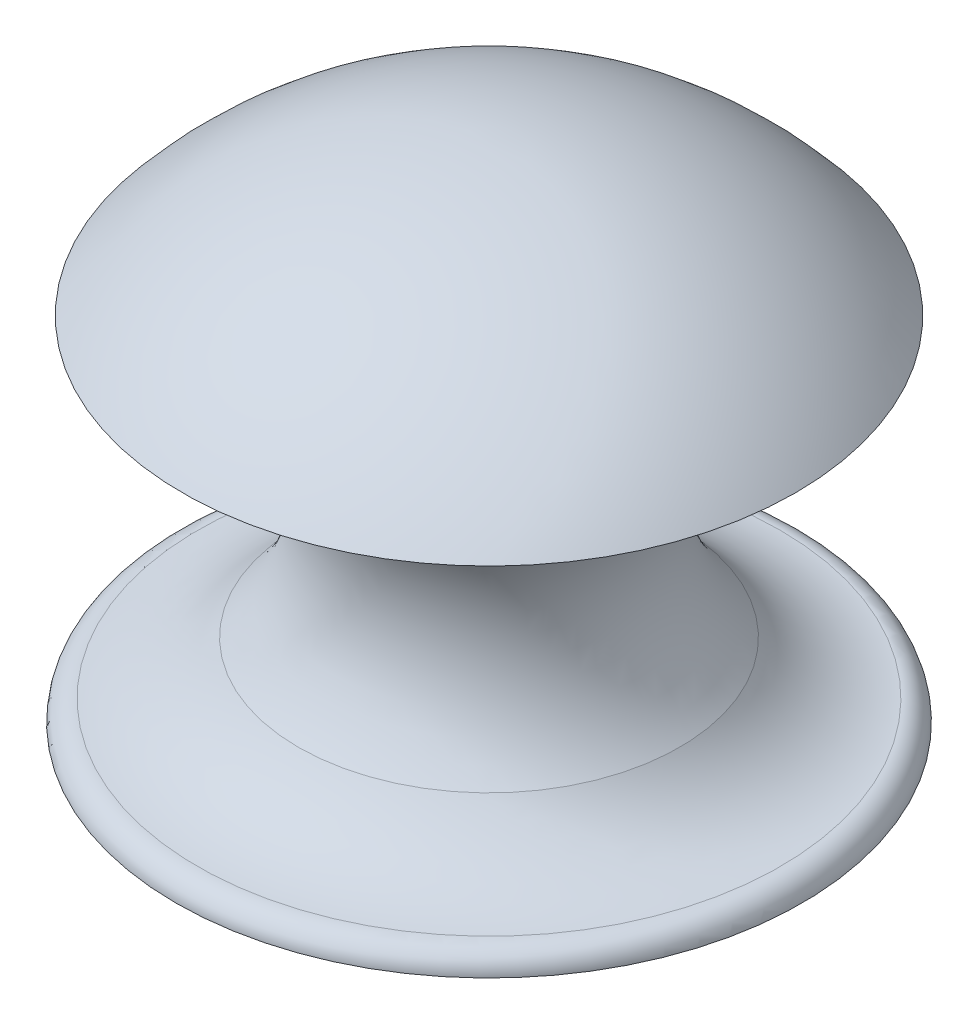
from build123d import *

# Parameters (mm, degrees)
SKETCH3_R          = 1.5
CUT_EXTRUDE2_DEPTH = 13


with BuildPart() as part:
    # Sketch1 → Revolve1 (revolve)
    with BuildSketch(Plane.XY, mode=Mode.PRIVATE) as revolve1_sk:
        with BuildLine():
            Line((0, 0), (0, 27))
            ThreePointArc((0, 27), (9.211074802, 24.939349426), (16.666049883, 19.150262594))
            ThreePointArc((16.666049883, 19.150262594), (8.466959251, 13.685208076), (10.355749103, 4.014407645))
            ThreePointArc((10.355749103, 4.014407645), (12.789115338, 1.999736062), (15.829018223, 1.139990011))
            ThreePointArc((15.829018223, 1.139990011), (16.650608773, 0.812513272), (17, 0))
            Line((17, 0), (0, 0))
        make_face()
    revolve(revolve1_sk.sketch.rotate(Axis((0, 0, 0), (0, 1, 0)), 90), axis=Axis((0, 0, 0), (0, 1, 0)))

    # Sketch3 → Cut-Extrude2 (cut)
    with BuildSketch(Plane.XZ):
        with Locations(Location((0, 0, 0), (0, 0, 270))):
            Circle(SKETCH3_R)
    extrude(amount=-CUT_EXTRUDE2_DEPTH, mode=Mode.SUBTRACT)


solid = part.part
